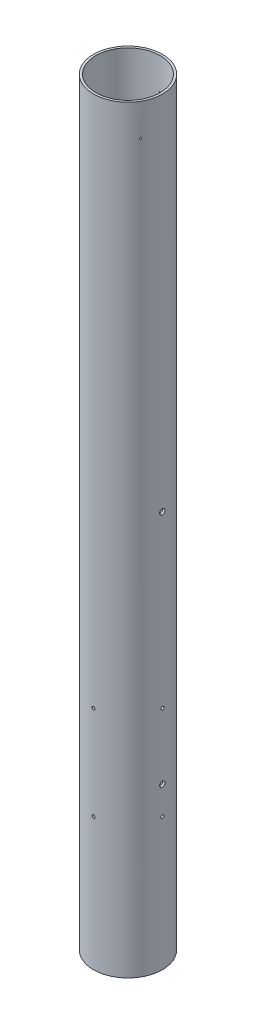
from build123d import *

# Parameters (mm, degrees)
SKETCH1_R                                  = 40.8178
SKETCH1_R_2                                = 38.1508
BOSS_EXTRUDE1_DEPTH                        = 898.525
RAILGUIDE_HOLE_CUT_REACH                   = 905.149
RAILGUIDE_HOLE_CUT_END_RADIUS              = 38.1508
SKETCH2_R                                  = 3.175
MOTOR_CASING_CENTERING_RING_CUT_REACH      = 905.149
MOTOR_CASING_CENTERING_RING_CUT_END_RADIUS = 38.1508
SKETCH3_R                                  = 1.778
CIRPATTERN1_COUNT                          = 4
SHEAR_PIN_CUT_REACH                        = 905.824
SHEAR_PIN_CUT_END_RADIUS                   = 38.1508
SKETCH4_R                                  = 0.9906
CIRPATTERN2_COUNT                          = 3


with BuildPart() as part:
    # Sketch1 → Boss-Extrude1 (new body)
    with BuildSketch(Plane(origin=(0, 0, 0), x_dir=(1, 0, 0), z_dir=(0, 1, 0))):
        with Locations(Location((0, 0, 0), (0, 0, 90))):
            Circle(SKETCH1_R)
        with Locations(Location((0, 0, 0), (0, 0, 90))):
            Circle(SKETCH1_R_2, mode=Mode.SUBTRACT)
    extrude(amount=BOSS_EXTRUDE1_DEPTH)

    # Railguide Hole Cut: up to this cylinder (the profile starts outside it)
    railguide_hole_cut_end = Plane(origin=(0, 330.2, 0), z_dir=(0, -1, 0)) * Cylinder(RAILGUIDE_HOLE_CUT_END_RADIUS, 2166.9996, mode=Mode.PRIVATE)
    # Sketch2 → Railguide Hole Cut (cut, up to the surface)
    with BuildSketch(Plane(origin=(40.8178, 0, 0), x_dir=(0, 0, -1), z_dir=(1, 0, 0)), mode=Mode.PRIVATE) as railguide_hole_cut_sk1:
        with Locations((0, 190.5)):
            Circle(SKETCH2_R)
    railguide_hole_cut_tool1 = extrude(railguide_hole_cut_sk1.sketch, amount=-RAILGUIDE_HOLE_CUT_REACH, mode=Mode.PRIVATE) - railguide_hole_cut_end
    add(railguide_hole_cut_tool1.solids().sort_by_distance((40.8178, 190.5, 0))[0], mode=Mode.SUBTRACT)
    # Sketch2 → Railguide Hole Cut (cut, up to the surface)
    with BuildSketch(Plane(origin=(40.8178, 0, 0), x_dir=(0, 0, -1), z_dir=(1, 0, 0)), mode=Mode.PRIVATE) as railguide_hole_cut_sk2:
        with Locations((0, 469.9)):
            Circle(SKETCH2_R)
    railguide_hole_cut_tool2 = extrude(railguide_hole_cut_sk2.sketch, amount=-RAILGUIDE_HOLE_CUT_REACH, mode=Mode.PRIVATE) - railguide_hole_cut_end
    add(railguide_hole_cut_tool2.solids().sort_by_distance((40.8178, 469.9, 0))[0], mode=Mode.SUBTRACT)

    # Motor Casing Centering Ring Cut: up to this cylinder (the profile starts outside it)
    motor_casing_centering_ring_cut_end = Plane(origin=(0, 212.725, 0), z_dir=(0, -1, 0)) * Cylinder(MOTOR_CASING_CENTERING_RING_CUT_END_RADIUS, 1998.7246, mode=Mode.PRIVATE)
    # Sketch3 → Motor Casing Centering Ring Cut (cut, up to the surface)
    with BuildSketch(Plane.XY.offset(40.8178), mode=Mode.PRIVATE) as motor_casing_centering_ring_cut_sk1:
        with Locations((0, 157.1625)):
            Circle(SKETCH3_R)
    motor_casing_centering_ring_cut_tool1 = extrude(motor_casing_centering_ring_cut_sk1.sketch, amount=-MOTOR_CASING_CENTERING_RING_CUT_REACH, mode=Mode.PRIVATE) - motor_casing_centering_ring_cut_end
    # Sketch3 → Motor Casing Centering Ring Cut (cut, up to the surface)
    with BuildSketch(Plane.XY.offset(40.8178), mode=Mode.PRIVATE) as motor_casing_centering_ring_cut_sk2:
        with Locations((0, 268.2875)):
            Circle(SKETCH3_R)
    motor_casing_centering_ring_cut_tool2 = extrude(motor_casing_centering_ring_cut_sk2.sketch, amount=-MOTOR_CASING_CENTERING_RING_CUT_REACH, mode=Mode.PRIVATE) - motor_casing_centering_ring_cut_end
    motor_casing_centering_ring_cut = motor_casing_centering_ring_cut_tool1.solids().sort_by_distance((0, 157.1625, 40.8178))[0] + motor_casing_centering_ring_cut_tool2.solids().sort_by_distance((0, 268.2875, 40.8178))[0]
    add(motor_casing_centering_ring_cut, mode=Mode.SUBTRACT)

    # CirPattern1: Motor Casing Centering Ring Cut ×4 about axis
    cirpattern1_axis = Axis((0, -55, 0), (0, 1, 0))
    for i in range(1, CIRPATTERN1_COUNT):
        add(motor_casing_centering_ring_cut.rotate(cirpattern1_axis, i * 360 / CIRPATTERN1_COUNT), mode=Mode.SUBTRACT)

    # Shear Pin Cut: up to this cylinder (the profile starts outside it)
    shear_pin_cut_end = Plane(origin=(0, 860.425, 0), z_dir=(0, -1, 0)) * Cylinder(SHEAR_PIN_CUT_END_RADIUS, 1888.9496, mode=Mode.PRIVATE)
    # Sketch4 → Shear Pin Cut (cut, up to the surface)
    with BuildSketch(Plane(origin=(35.349251727, 0, 20.4089), x_dir=(0, -1, 0), z_dir=(0.866025403784438, 0, 0.500000000000001)), mode=Mode.PRIVATE) as shear_pin_cut_sk1:
        with Locations(Location((-860.425, 0, 0), (0, 0, 90))):
            Circle(SKETCH4_R)
    shear_pin_cut_tool1 = extrude(shear_pin_cut_sk1.sketch, amount=-SHEAR_PIN_CUT_REACH, mode=Mode.PRIVATE) - shear_pin_cut_end
    shear_pin_cut = shear_pin_cut_tool1.solids().sort_by_distance((35.349252, 860.425, 20.4089))[0]
    add(shear_pin_cut, mode=Mode.SUBTRACT)

    # CirPattern2: Shear Pin Cut ×3 about axis
    cirpattern2_axis = Axis((0, -55, 0), (0, 1, 0))
    for i in range(1, CIRPATTERN2_COUNT):
        add(shear_pin_cut.rotate(cirpattern2_axis, i * 360 / CIRPATTERN2_COUNT), mode=Mode.SUBTRACT)


solid = part.part
